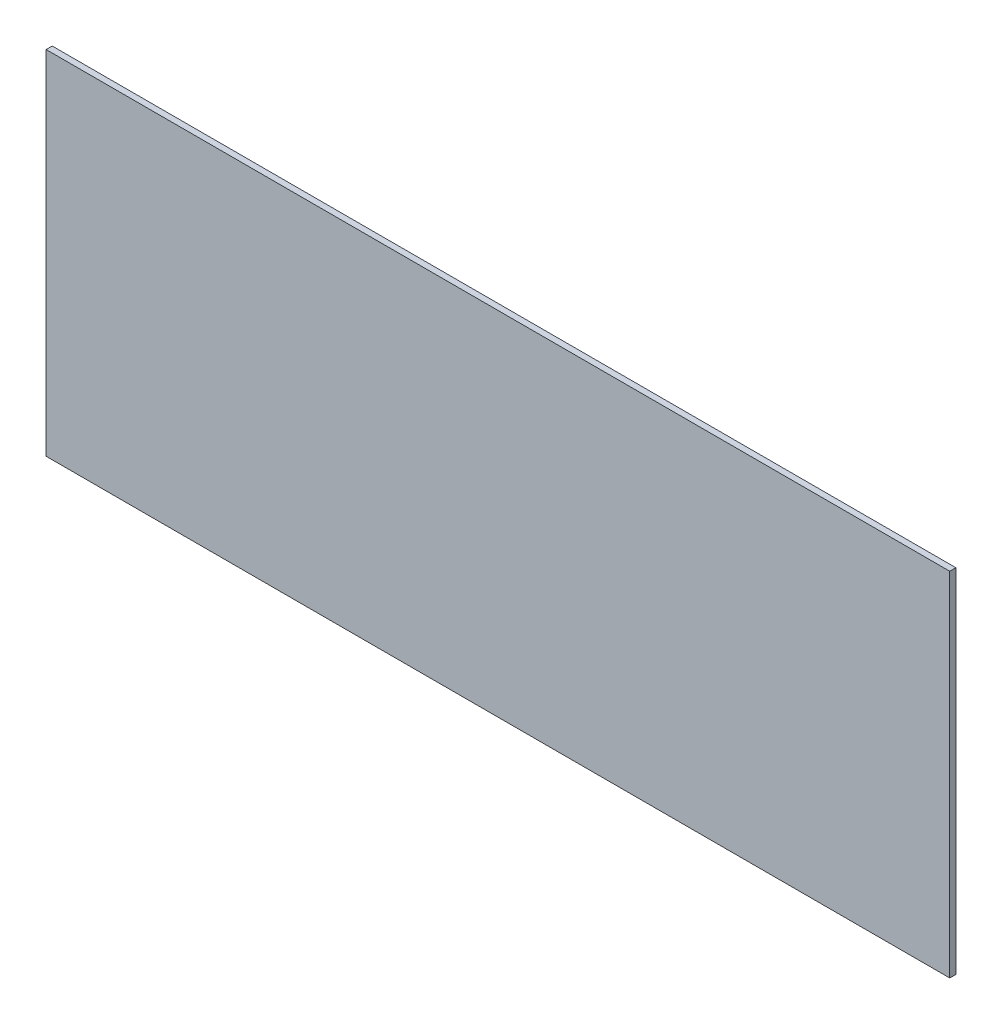
from build123d import *

# Parameters (mm, degrees)
FKAP_CAM_IC_4MM_1_START = 22
SKETCH1_W               = 590
SKETCH1_H               = 230
FKAP_CAM_IC_4MM_1_DEPTH = 4


with BuildPart() as part:
    # Sketch1 → FKAP_cam_ic_4mm_1 (new body)
    with BuildSketch(Plane.XY.offset(FKAP_CAM_IC_4MM_1_START)):
        with Locations((320, 140)):
            Rectangle(SKETCH1_W, SKETCH1_H)
    extrude(amount=FKAP_CAM_IC_4MM_1_DEPTH)


solid = part.part
